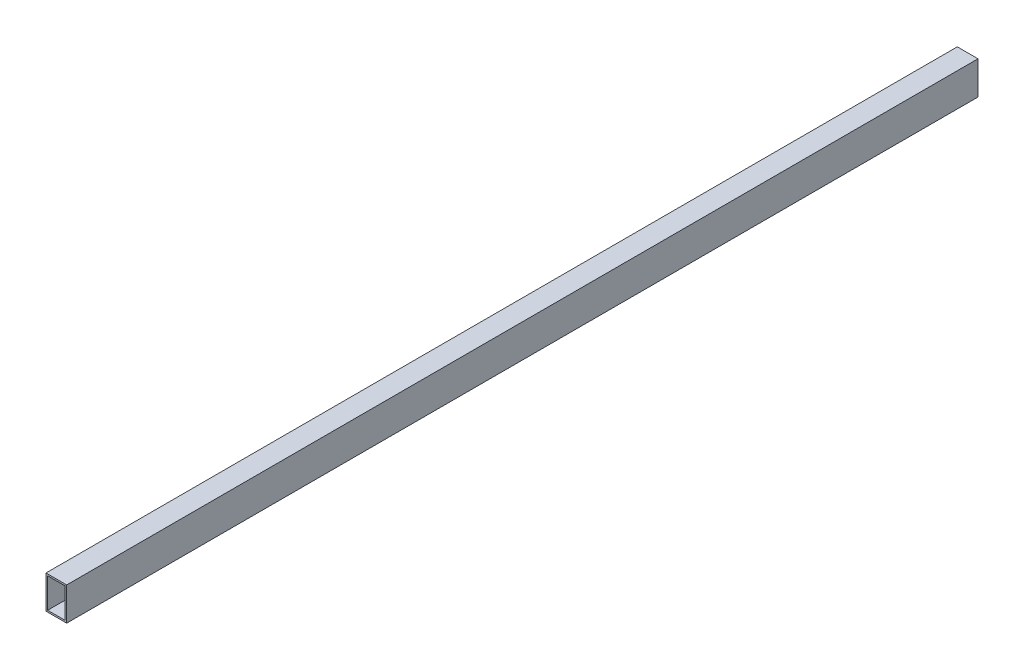
from build123d import *

# Parameters (mm, degrees)
SKETCH1_W           = 50
SKETCH1_H           = 80
BOSS_EXTRUDE1_DEPTH = 2200
SKETCH2_W           = 42
SKETCH2_H           = 72
CUT_EXTRUDE1_DEPTH  = 2200


with BuildPart() as part:
    # Sketch1 → Boss-Extrude1 (new body)
    with BuildSketch(Plane.XY):
        Rectangle(SKETCH1_W, SKETCH1_H)
    extrude(amount=BOSS_EXTRUDE1_DEPTH)

    # Sketch2 → Cut-Extrude1 (cut)
    with BuildSketch(Plane(origin=(0, 0, 0), x_dir=(-1, 0, 0), z_dir=(0, 0, -1))):
        Rectangle(SKETCH2_W, SKETCH2_H)
    extrude(amount=-CUT_EXTRUDE1_DEPTH, mode=Mode.SUBTRACT)


solid = part.part
